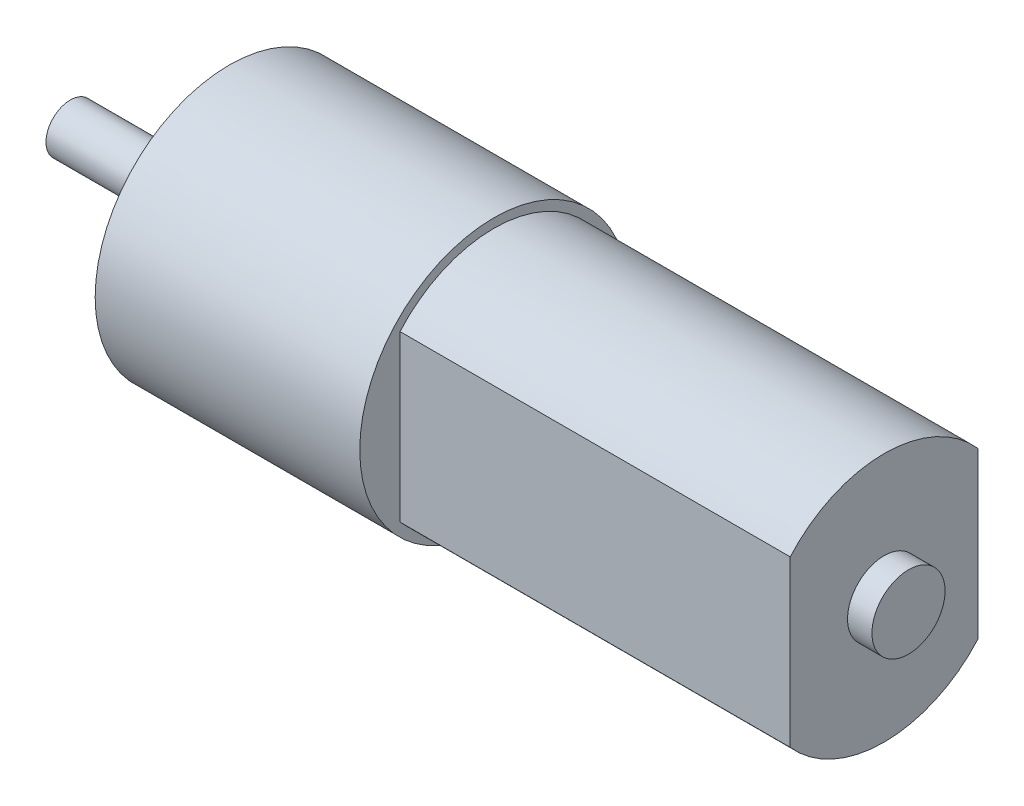
from build123d import *

# Parameters (mm, degrees)
ESQUISSE2_W             = 8.320302529
ESQUISSE2_H             = 23.371875391
ESQUISSE2_W_2           = 7.922092332
ENL_V_MAT_EXTRU_1_DEPTH = 32
ENL_V_START             = -2
ENL_V_MAT_EXTRU_2_DEPTH = 2
ESQUISSE4_R             = 1
ENL_V_MAT_EXTRU_3_DEPTH = 4


with BuildPart() as part:
    # Esquisse1 → Révolution1 (revolve)
    with BuildSketch(Plane.XY, mode=Mode.PRIVATE) as r_volution1_sk:
        Polygon((-13.035736805, 0), (-13.035736805, -2), (-3, -2), (-3, -4), (-2, -4), (-2, -7), (0, -7), (0, -11), (21.7, -11), (21.7, -10.25), (53.7, -10.25), (53.7, -3), (55.7, -3), (55.7, 0), align=None)
    revolve(r_volution1_sk.sketch.rotate(Axis((38.703399471, 0, 0), (-1, 0, 0)), 270), axis=Axis((38.703399471, 0, 0), (-1, 0, 0)))

    # Esquisse2 → Enlèv. mat.-Extru.1 (cut)
    with BuildSketch(Plane(origin=(53.7, 0, 0), x_dir=(0, 0, -1), z_dir=(1, 0, 0))):
        with Locations((-11.860151265, -0.490104857)):
            Rectangle(ESQUISSE2_W, ESQUISSE2_H)
        with Locations((11.661046166, -0.490104857)):
            Rectangle(ESQUISSE2_W_2, ESQUISSE2_H)
    extrude(amount=-ENL_V_MAT_EXTRU_1_DEPTH, mode=Mode.SUBTRACT)

    # Esquisse3 → Enlèv. mat.-Extru.2 (cut)
    with BuildSketch(Plane.ZY.offset(2).offset(ENL_V_START)):
        with BuildLine():
            Line((6.792150444, 1.69313093), (1.69313093, 6.792150444))
            ThreePointArc((1.69313093, 6.792150444), (4.949747468, 4.949747468), (6.792150444, 1.69313093))
        make_face()
        with BuildLine():
            Line((-6.792150444, -1.69313093), (-1.69313093, -6.792150444))
            ThreePointArc((-1.69313093, -6.792150444), (-4.949747468, -4.949747468), (-6.792150444, -1.69313093))
        make_face()
    extrude(amount=ENL_V_MAT_EXTRU_2_DEPTH, mode=Mode.SUBTRACT)

    # Esquisse4 → Enlèv. mat.-Extru.3 (cut)
    with BuildSketch(Plane.ZY):
        with Locations((0, 9)):
            Circle(ESQUISSE4_R)
        with Locations((-9, 0)):
            Circle(ESQUISSE4_R)
        with Locations((0, -9)):
            Circle(ESQUISSE4_R)
        with Locations((9, 0)):
            Circle(ESQUISSE4_R)
    extrude(amount=-ENL_V_MAT_EXTRU_3_DEPTH, mode=Mode.SUBTRACT)


solid = part.part
